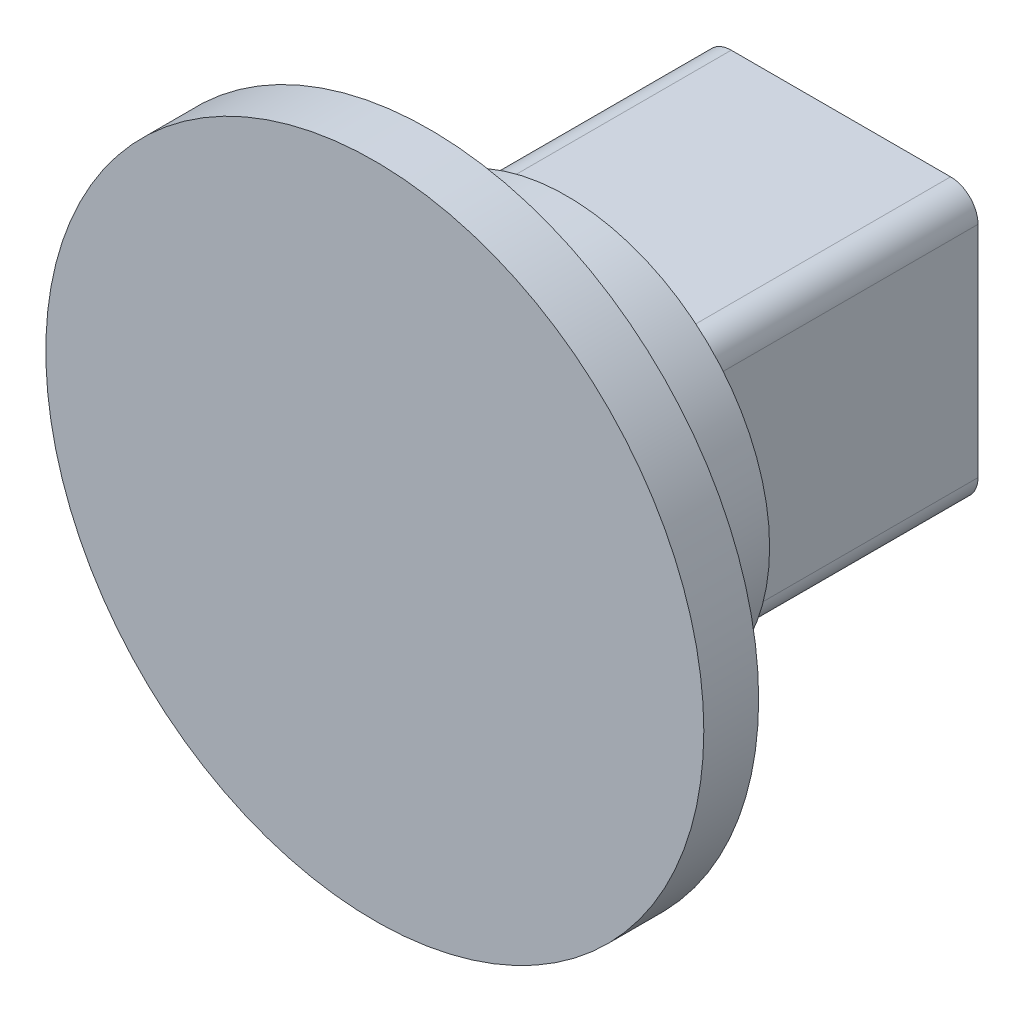
from build123d import *

# Parameters (mm, degrees)
SKETCH1_W           = 10
SKETCH1_H           = 10
BOSS_EXTRUDE1_DEPTH = 10
SKETCH1_4_R         = 7.4
BOSS_EXTRUDE2_DEPTH = 5
FILLET1_R           = 1
BOSS_EXTRUDE3_START = 5
SKETCH2_R           = 12
BOSS_EXTRUDE3_DEPTH = 2


with BuildPart() as part:
    # Sketch1 → Boss-Extrude1 (new body)
    with BuildSketch(Plane.XY):
        Rectangle(SKETCH1_W, SKETCH1_H)
    extrude(amount=-BOSS_EXTRUDE1_DEPTH)

    # Sketch1<4> → Boss-Extrude2 (add)
    with BuildSketch(Plane.XY):
        Circle(SKETCH1_4_R)
    extrude(amount=BOSS_EXTRUDE2_DEPTH)

    # Fillet1
    fillet1_edges = [part.edges().sort_by_distance(p)[0] for p in [
        (-5, -5, -5),
        (-5, 5, -5),
        (5, 5, -5),
        (5, -5, -5),
    ]]
    fillet(fillet1_edges, radius=FILLET1_R)

    # Sketch2 → Boss-Extrude3 (add)
    with BuildSketch(Plane.XY.offset(BOSS_EXTRUDE3_START)):
        Circle(SKETCH2_R)
    extrude(amount=BOSS_EXTRUDE3_DEPTH)


solid = part.part
